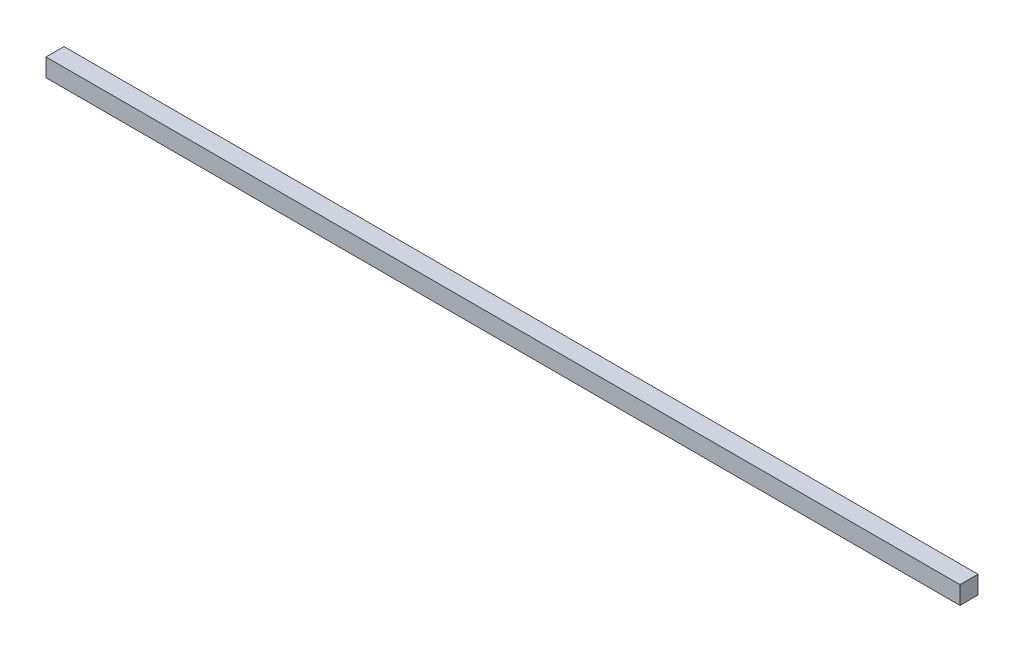
from build123d import *

# Parameters (mm, degrees)
SKETCH_1_W      = 6
SKETCH_1_H      = 6
EXTRUDE_1_DEPTH = 304.5


with BuildPart() as part:
    # Эскиз1 → Бобышка-Вытянуть1 (new body)
    with BuildSketch(Plane(origin=(0, 0, 0), x_dir=(0, 0, -1), z_dir=(1, 0, 0))):
        with Locations((3, 3)):
            Rectangle(SKETCH_1_W, SKETCH_1_H)
    extrude(amount=EXTRUDE_1_DEPTH)


solid = part.part
